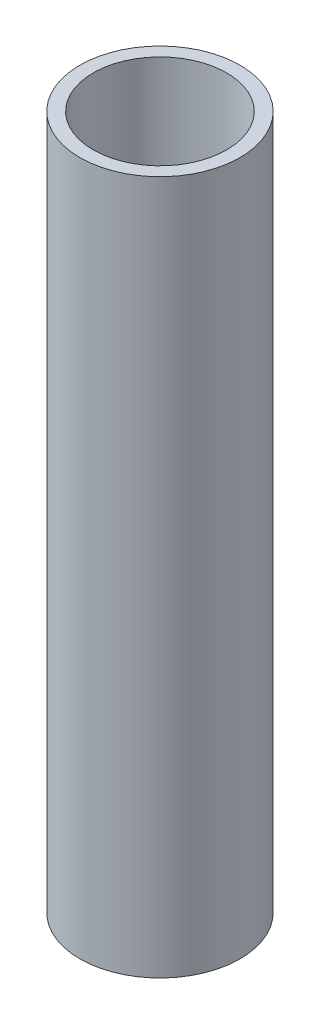
from build123d import *

# Parameters (mm, degrees)
SKETCH1_R           = 4.7625
SKETCH1_R_2         = 3.96875
BOSS_EXTRUDE1_DEPTH = 41.275


with BuildPart() as part:
    # Sketch1 → Boss-Extrude1 (new body)
    with BuildSketch(Plane(origin=(0, 0, 0), x_dir=(1, 0, 0), z_dir=(0, 1, 0))):
        with Locations(Location((0, 0, 0), (0, 0, 270))):
            Circle(SKETCH1_R)
        with Locations(Location((0, 0, 0), (0, 0, 270))):
            Circle(SKETCH1_R_2, mode=Mode.SUBTRACT)
    extrude(amount=BOSS_EXTRUDE1_DEPTH)


solid = part.part
